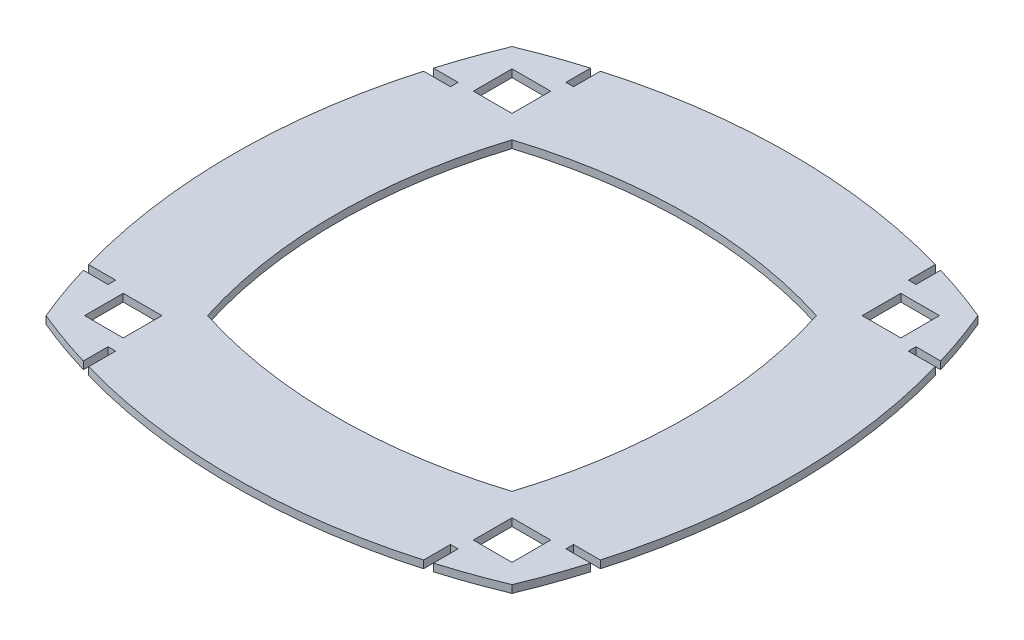
from build123d import *

# Parameters (mm, degrees)
SKETCH1_W           = 25.4
SKETCH1_H           = 25.4
BOSS_EXTRUDE1_DEPTH = 5


with BuildPart() as part:
    # Sketch1 → Boss-Extrude1 (new body)
    with BuildSketch(Plane(origin=(0, 0, 0), x_dir=(1, 0, 0), z_dir=(0, 1, 0))):
        with BuildLine():
            Line((115, 150.4), (110, 150.4))
            Line((110, 150.4), (110, 168.087409379))
            ThreePointArc((110, 168.087409379), (0, 183.509718919), (-110, 168.087409379))
            Line((-110, 168.087409379), (-110, 150.4))
            Line((-110, 150.4), (-115, 150.4))
            Line((-115, 150.4), (-115, 166.621974009))
            ThreePointArc((-115, 166.621974009), (-134.203796304, 160.324449334), (-153.065, 153.065))
            ThreePointArc((-153.065, 153.065), (-160.324449334, 134.203796304), (-166.621974009, 115))
            Line((-166.621974009, 115), (-150.4, 115))
            Line((-150.4, 115), (-150.4, 110))
            Line((-150.4, 110), (-168.087409379, 110))
            ThreePointArc((-168.087409379, 110), (-183.509718919, 0), (-168.087409379, -110))
            Line((-168.087409379, -110), (-150.4, -110))
            Line((-150.4, -110), (-150.4, -115))
            Line((-150.4, -115), (-166.621974009, -115))
            ThreePointArc((-166.621974009, -115), (-160.324449334, -134.203796304), (-153.065, -153.065))
            ThreePointArc((-153.065, -153.065), (-134.203796304, -160.324449334), (-115, -166.621974009))
            Line((-115, -166.621974009), (-115, -150.4))
            Line((-115, -150.4), (-110, -150.4))
            Line((-110, -150.4), (-110, -168.087409379))
            ThreePointArc((-110, -168.087409379), (0, -183.509718919), (110, -168.087409379))
            Line((110, -168.087409379), (110, -150.4))
            Line((110, -150.4), (115, -150.4))
            Line((115, -150.4), (115, -166.621974009))
            ThreePointArc((115, -166.621974009), (134.203796304, -160.324449334), (153.065, -153.065))
            ThreePointArc((153.065, -153.065), (160.324449334, -134.203796304), (166.621974009, -115))
            Line((166.621974009, -115), (150.4, -115))
            Line((150.4, -115), (150.4, -110))
            Line((150.4, -110), (168.087409379, -110))
            ThreePointArc((168.087409379, -110), (183.509718919, 0), (168.087409379, 110))
            Line((168.087409379, 110), (150.4, 110))
            Line((150.4, 110), (150.4, 115))
            Line((150.4, 115), (166.621974009, 115))
            ThreePointArc((166.621974009, 115), (160.324449334, 134.203796304), (153.065, 153.065))
            ThreePointArc((153.065, 153.065), (134.203796304, 160.324449334), (115, 166.621974009))
            Line((115, 166.621974009), (115, 150.4))
        make_face()
        with Locations((127.7, 127.7)):
            Rectangle(SKETCH1_W, SKETCH1_H, mode=Mode.SUBTRACT)
        with Locations((-127.7, 127.7)):
            Rectangle(SKETCH1_W, SKETCH1_H, mode=Mode.SUBTRACT)
        with Locations((127.7, -127.7)):
            Rectangle(SKETCH1_W, SKETCH1_H, mode=Mode.SUBTRACT)
        with Locations((-127.7, -127.7)):
            Rectangle(SKETCH1_W, SKETCH1_H, mode=Mode.SUBTRACT)
        with BuildLine():
            ThreePointArc((-100, 100), (0, 115.422505685), (100, 100))
            ThreePointArc((100, 100), (115.422505685, 0), (100, -100))
            ThreePointArc((100, -100), (0, -115.422505685), (-100, -100))
            ThreePointArc((-100, -100), (-115.422505685, 0), (-100, 100))
        make_face(mode=Mode.SUBTRACT)
    extrude(amount=BOSS_EXTRUDE1_DEPTH)


solid = part.part
